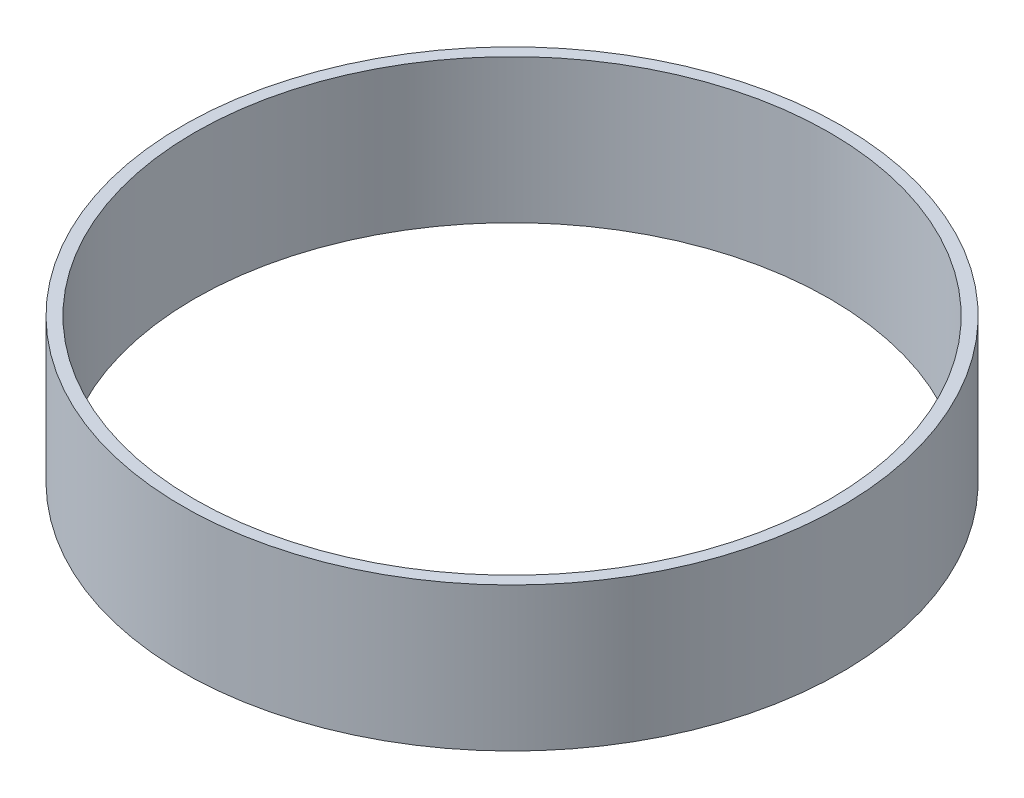
from build123d import *

# Parameters (mm, degrees)
SKETCH1_R           = 87.3125
SKETCH1_R_2         = 84.1375
BOSS_EXTRUDE1_DEPTH = 38.1


with BuildPart() as part:
    # Sketch1 → Boss-Extrude1 (new body)
    with BuildSketch(Plane(origin=(0, 0, 0), x_dir=(1, 0, 0), z_dir=(0, 1, 0))):
        with Locations(Location((0, 0, 0), (0, 0, 90))):
            Circle(SKETCH1_R)
        with Locations(Location((0, 0, 0), (0, 0, 90))):
            Circle(SKETCH1_R_2, mode=Mode.SUBTRACT)
    extrude(amount=BOSS_EXTRUDE1_DEPTH)


solid = part.part
